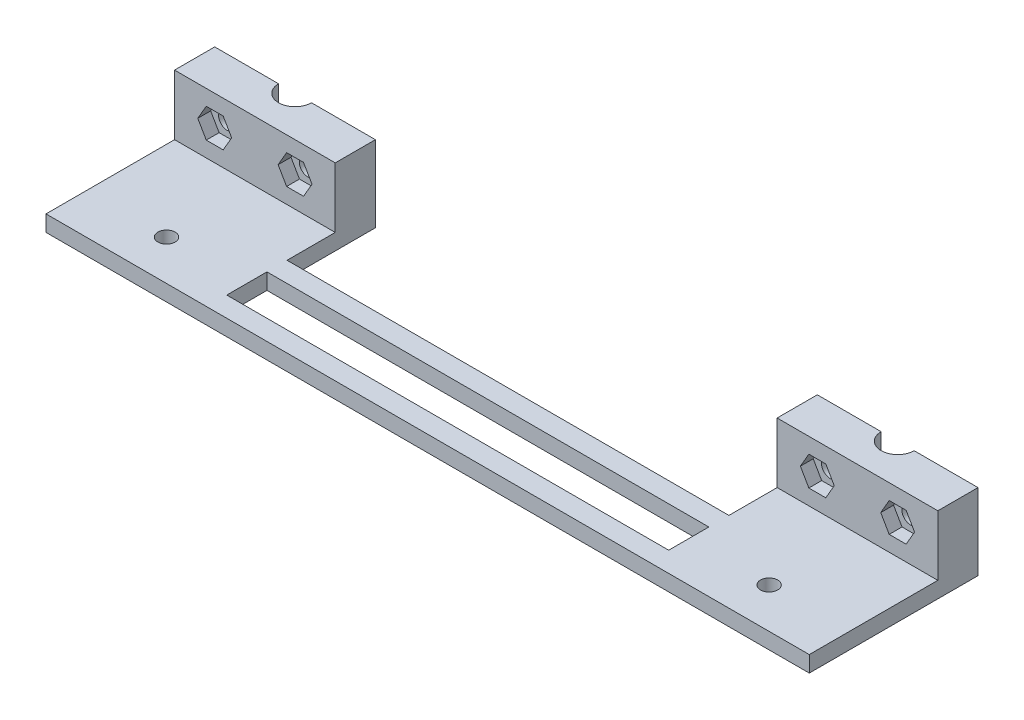
from build123d import *

# Parameters (mm, degrees)
SKIZZE1_W                       = 55
SKIZZE1_H                       = 5
AUFSATZ_LINEAR_AUSTRAGEN1_DEPTH = 4
AUFSATZ_LINEAR_AUSTRAGEN2_DEPTH = 15
SCHNITT_LINEAR_AUSTRAGEN1_DEPTH = 3.2
SCHNITT_LINEAR_AUSTRAGEN2_DEPTH = 15


with BuildPart() as part:
    # Skizze1 → Aufsatz-Linear austragen1 (new body)
    with BuildSketch(Plane(origin=(0, 0, 0), x_dir=(1, 0, 0), z_dir=(0, 1, 0))):
        with BuildLine():
            Line((-55, -5), (-55, 0))
            Line((-55, 0), (-72.85, 0))
            ThreePointArc((-72.85, 0), (-76.52027958, -1.52027958), (-75, 2.15))
            Line((-75, 2.15), (-75, 27.9))
            ThreePointArc((-75, 27.9), (-77.899137803, 29.100862197), (-79.1, 32))
            Line((-79.1, 32), (-95, 32))
            Line((-95, 32), (-95, -10))
            Line((-95, -10), (-55, -10))
            Line((-55, -10), (-55, -5))
        make_face()
        with BuildLine():
            Line((-72.85, 0), (-55, 0))
            Line((-55, 0), (-55, 5))
            Line((-55, 5), (-55, 10))
            Line((-55, 10), (-55, 32))
            Line((-55, 32), (-70.9, 32))
            ThreePointArc((-70.9, 32), (-72.100862197, 29.100862197), (-75, 27.9))
            Line((-75, 27.9), (-75, 2.15))
            ThreePointArc((-75, 2.15), (-73.47972042, 1.52027958), (-72.85, 0))
        make_face()
        with Locations((-27.5, 7.5)):
            Rectangle(SKIZZE1_W, SKIZZE1_H)
        with Locations((27.5, 7.5)):
            Rectangle(SKIZZE1_W, SKIZZE1_H)
        with BuildLine():
            Line((55, 5), (55, 0))
            Line((55, 0), (72.85, 0))
            ThreePointArc((72.85, 0), (73.47972042, 1.52027958), (75, 2.15))
            Line((75, 2.15), (75, 27.9))
            ThreePointArc((75, 27.9), (72.100862197, 29.100862197), (70.9, 32))
            Line((70.9, 32), (55, 32))
            Line((55, 32), (55, 10))
            Line((55, 10), (55, 5))
        make_face()
        with BuildLine():
            Line((72.85, 0), (55, 0))
            Line((55, 0), (55, -5))
            Line((55, -5), (55, -10))
            Line((55, -10), (95, -10))
            Line((95, -10), (95, 32))
            Line((95, 32), (79.1, 32))
            ThreePointArc((79.1, 32), (77.899137803, 29.100862197), (75, 27.9))
            Line((75, 27.9), (75, 2.15))
            ThreePointArc((75, 2.15), (76.52027958, 1.52027958), (77.15, 0))
            ThreePointArc((77.15, 0), (75, -2.15), (72.85, 0))
        make_face()
        with Locations((27.5, -7.5)):
            Rectangle(SKIZZE1_W, SKIZZE1_H)
        with Locations((-27.5, -7.5)):
            Rectangle(SKIZZE1_W, SKIZZE1_H)
    extrude(amount=AUFSATZ_LINEAR_AUSTRAGEN1_DEPTH)

    # Skizze2 → Aufsatz-Linear austragen2 (add)
    with BuildSketch(Plane(origin=(0, 4, 0), x_dir=(1, 0, 0), z_dir=(0, 1, 0))):
        with BuildLine():
            Line((-95, 32), (-95, 22))
            Line((-95, 22), (-55, 22))
            Line((-55, 22), (-55, 32))
            Line((-55, 32), (-70.9, 32))
            ThreePointArc((-70.9, 32), (-75, 27.9), (-79.1, 32))
            Line((-79.1, 32), (-95, 32))
        make_face()
        with BuildLine():
            Line((55, 32), (55, 22))
            Line((55, 22), (95, 22))
            Line((95, 22), (95, 32))
            Line((95, 32), (79.1, 32))
            ThreePointArc((79.1, 32), (75, 27.9), (70.9, 32))
            Line((70.9, 32), (55, 32))
        make_face()
    extrude(amount=AUFSATZ_LINEAR_AUSTRAGEN2_DEPTH)

    # Skizze3 → Schnitt-Linear austragen1 (cut)
    with BuildSketch(Plane.XY.offset(-22)):
        Polygon((-87.107328483, 15.15), (-89.214656965, 11.5), (-85, 11.5), (-80.785343035, 11.5), (-82.892671517, 15.15), align=None)
        Polygon((-85, 11.5), (-89.214656965, 11.5), (-87.107328483, 7.85), (-82.892671517, 7.85), (-80.785343035, 11.5), align=None)
        Polygon((-67.107328483, 15.15), (-69.214656965, 11.5), (-65, 11.5), (-60.785343035, 11.5), (-62.892671517, 15.15), align=None)
        Polygon((-65, 11.5), (-69.214656965, 11.5), (-67.107328483, 7.85), (-62.892671517, 7.85), (-60.785343035, 11.5), align=None)
        Polygon((85, 11.5), (89.214656965, 11.5), (87.107328483, 15.15), (82.892671517, 15.15), (80.785343035, 11.5), align=None)
        Polygon((87.107328483, 7.85), (89.214656965, 11.5), (85, 11.5), (80.785343035, 11.5), (82.892671517, 7.85), align=None)
        Polygon((65, 11.5), (69.214656965, 11.5), (67.107328483, 15.15), (62.892671517, 15.15), (60.785343035, 11.5), align=None)
        Polygon((67.107328483, 7.85), (69.214656965, 11.5), (65, 11.5), (60.785343035, 11.5), (62.892671517, 7.85), align=None)
    extrude(amount=-SCHNITT_LINEAR_AUSTRAGEN1_DEPTH, mode=Mode.SUBTRACT)

    # Skizze4 → Schnitt-Linear austragen2 (cut)
    with BuildSketch(Plane.XY.offset(-22)):
        with BuildLine():
            ThreePointArc((-87.231768347, 11.5), (-85.081768347, 9.35), (-82.931768347, 11.5))
            Line((-82.931768347, 11.5), (-85.081768347, 11.5))
            Line((-85.081768347, 11.5), (-87.231768347, 11.5))
        make_face()
        with BuildLine():
            Line((-85.081768347, 11.5), (-82.931768347, 11.5))
            ThreePointArc((-82.931768347, 11.5), (-85.081768347, 13.65), (-87.231768347, 11.5))
            Line((-87.231768347, 11.5), (-85.081768347, 11.5))
        make_face()
        with BuildLine():
            ThreePointArc((-67.15, 11.5), (-65, 9.35), (-62.85, 11.5))
            Line((-62.85, 11.5), (-65, 11.5))
            Line((-65, 11.5), (-67.15, 11.5))
        make_face()
        with BuildLine():
            Line((-65, 11.5), (-62.85, 11.5))
            ThreePointArc((-62.85, 11.5), (-65, 13.65), (-67.15, 11.5))
            Line((-67.15, 11.5), (-65, 11.5))
        make_face()
        with BuildLine():
            ThreePointArc((62.85, 11.5), (65, 9.35), (67.15, 11.5))
            Line((67.15, 11.5), (65, 11.5))
            Line((65, 11.5), (62.85, 11.5))
        make_face()
        with BuildLine():
            Line((65, 11.5), (67.15, 11.5))
            ThreePointArc((67.15, 11.5), (65, 13.65), (62.85, 11.5))
            Line((62.85, 11.5), (65, 11.5))
        make_face()
        with BuildLine():
            ThreePointArc((82.85, 11.5), (85, 9.35), (87.15, 11.5))
            Line((87.15, 11.5), (85, 11.5))
            Line((85, 11.5), (82.85, 11.5))
        make_face()
        with BuildLine():
            Line((85, 11.5), (87.15, 11.5))
            ThreePointArc((87.15, 11.5), (85, 13.65), (82.85, 11.5))
            Line((82.85, 11.5), (85, 11.5))
        make_face()
    extrude(amount=-SCHNITT_LINEAR_AUSTRAGEN2_DEPTH, mode=Mode.SUBTRACT)


solid = part.part
